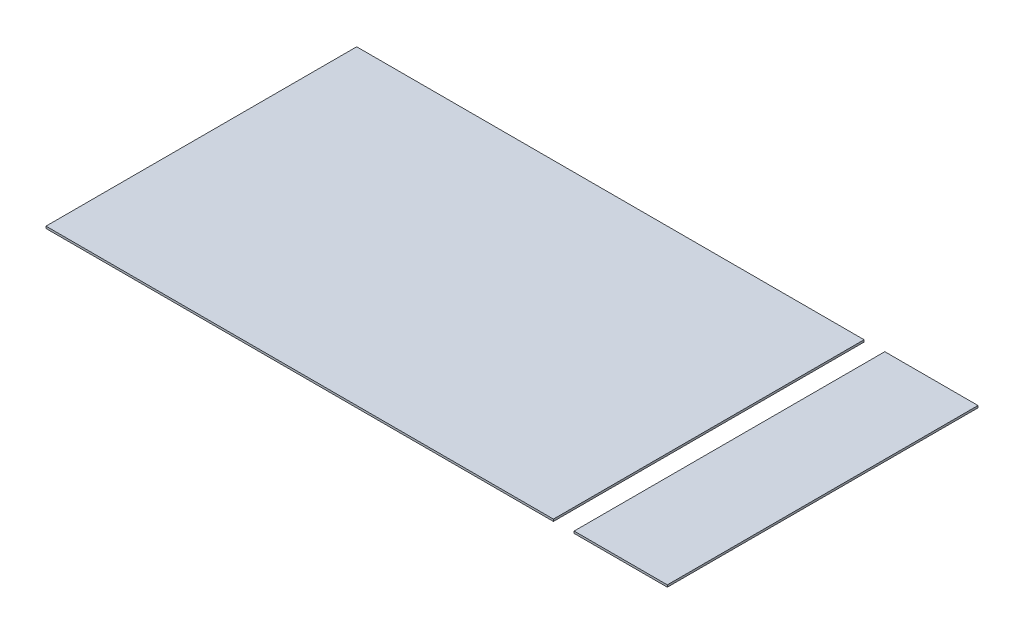
from build123d import *

# Parameters (mm, degrees)
SKETCH1_W             = 24.5
SKETCH1_H             = 15
BOSS_EXTRUDE1_DEPTH   = 0.1
SKETCH1_W_2           = 4.5
BOSS_EXTRUDE1_2_DEPTH = 0.1


with BuildPart() as part:
    # Sketch1 → Boss-Extrude1 (new body)
    with BuildSketch(Plane(origin=(0, 0, 0), x_dir=(1, 0, 0), z_dir=(0, 1, 0))):
        with Locations((3.962158809, -3.61662531)):
            Rectangle(SKETCH1_W, SKETCH1_H)
    extrude(amount=BOSS_EXTRUDE1_DEPTH)


with BuildPart() as body_2:
    # Sketch1 → Boss-Extrude1 2 (new body)
    with BuildSketch(Plane(origin=(0, 0, 0), x_dir=(1, 0, 0), z_dir=(0, 1, 0))):
        with Locations((19.462158809, -3.61662531)):
            Rectangle(SKETCH1_W_2, SKETCH1_H)
    extrude(amount=BOSS_EXTRUDE1_2_DEPTH)


solid = Compound([part.part, body_2.part])
